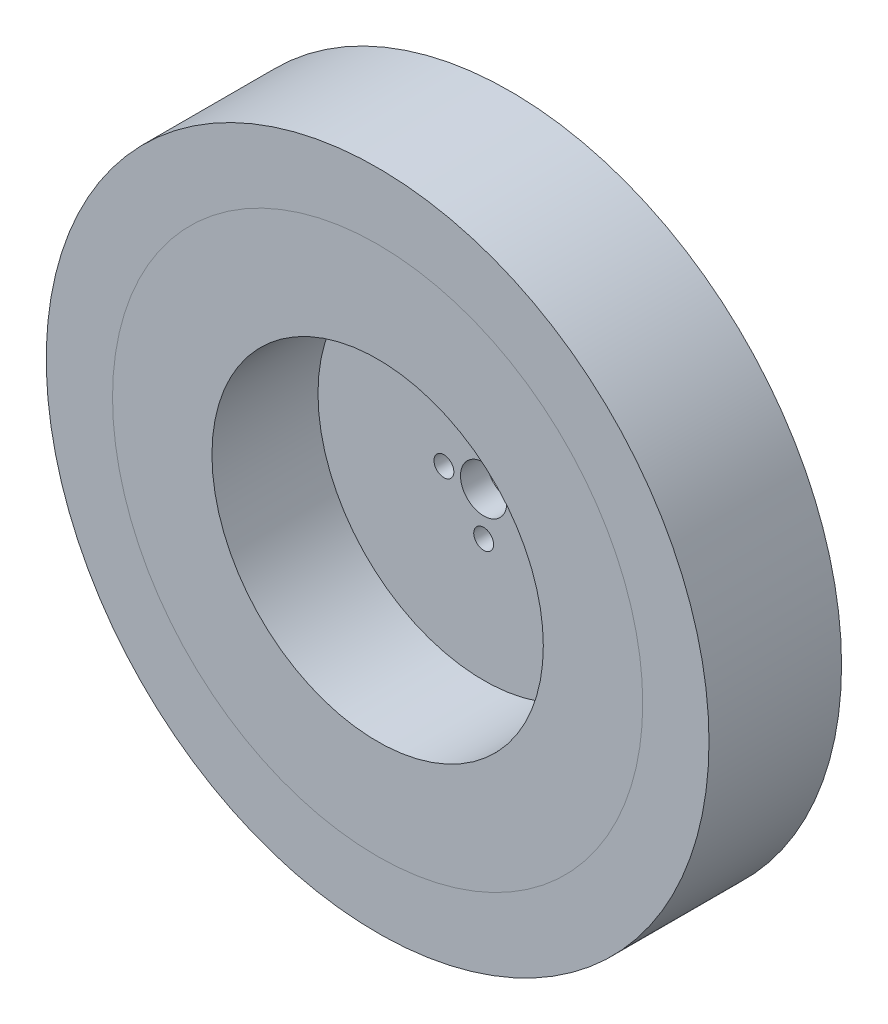
from build123d import *

# Parameters (mm, degrees)
SKETCH_1_R          = 50
SKETCH_1_R_2        = 40
EXTRUDE_1_DEPTH     = 10
SKETCH_3_R          = 40
SKETCH_3_R_2        = 37
EXTRUDE_2_DEPTH     = 10
SKETCH_4_R          = 37
EXTRUDE_3_DEPTH     = 4
SKETCH_5_R          = 3.5
SKETCH_5_R_2        = 1.5
CUT_EXTRUDE_1_DEPTH = 73.498275842
SKETCH_6_R          = 37
SKETCH_6_R_2        = 25
EXTRUDE_4_DEPTH     = 16


with BuildPart() as part:
    # 草图1 → 凸台-拉伸1 (new, symmetric)
    with BuildSketch(Plane.XY):
        Circle(SKETCH_1_R)
        Circle(SKETCH_1_R_2, mode=Mode.SUBTRACT)
    extrude(amount=EXTRUDE_1_DEPTH, both=True)


with BuildPart() as body_2:
    # 草图3 → 凸台-拉伸2 (new, symmetric)
    with BuildSketch(Plane.XY):
        Circle(SKETCH_3_R)
        Circle(SKETCH_3_R_2, mode=Mode.SUBTRACT)
    extrude(amount=EXTRUDE_2_DEPTH, both=True)

    # 草图4 → 凸台-拉伸3 (add)
    with BuildSketch(Plane(origin=(0, 0, -10), x_dir=(-1, 0, 0), z_dir=(0, 0, -1))):
        Circle(SKETCH_4_R)
    extrude(amount=-EXTRUDE_3_DEPTH)

    # 草图5 → 切除-拉伸1 (cut, through all)
    with BuildSketch(Plane.XY.offset(-6)):
        Circle(SKETCH_5_R)
        with Locations((0, 6.5)):
            Circle(SKETCH_5_R_2)
        with Locations((-6, 0)):
            Circle(SKETCH_5_R_2)
        with Locations((6, 0)):
            Circle(SKETCH_5_R_2)
        with Locations((0, -6.5)):
            Circle(SKETCH_5_R_2)
    extrude(amount=-CUT_EXTRUDE_1_DEPTH, mode=Mode.SUBTRACT)

    # 草图6 → 凸台-拉伸4 (add)
    with BuildSketch(Plane.XY.offset(-6)):
        Circle(SKETCH_6_R)
        Circle(SKETCH_6_R_2, mode=Mode.SUBTRACT)
    extrude(amount=EXTRUDE_4_DEPTH)


solid = Compound([part.part, body_2.part])
